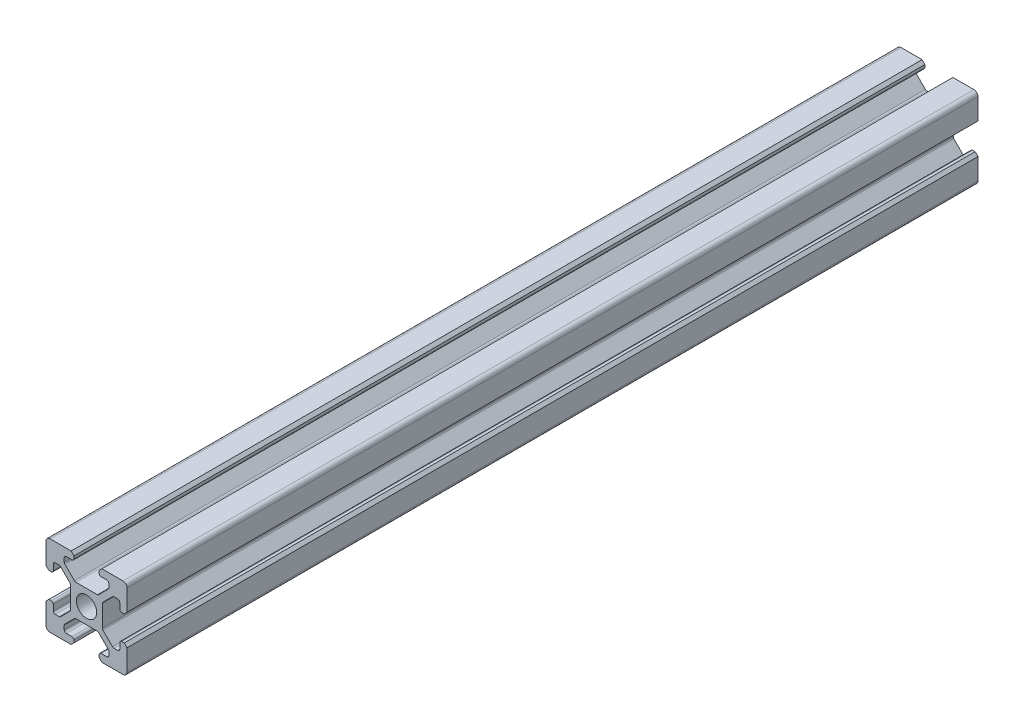
from build123d import *

# Parameters (mm, degrees)
SKETCH1_R           = 2.5
BOSS_EXTRUDE1_DEPTH = 105
FILLET1_R           = 0.5
FILLET2_R           = 0.5
FILLET3_R           = 1


with BuildPart() as part:
    # Sketch1 → Boss-Extrude1 (new, symmetric)
    with BuildSketch(Plane.XY):
        Polygon((3.9, -2.839339828), (6.560660172, -5.5), (8.200660172, -5.5), (8.200660172, -3.1), (9.3, -3.1), (10, -3.8), (10, -10), (3.8, -10), (3.1, -9.3), (3.1, -8.200660172), (5.5, -8.200660172), (5.5, -6.560660172), (2.839339828, -3.9), (-2.839339828, -3.9), (-5.5, -6.560660172), (-5.5, -8.200660172), (-3.1, -8.200660172), (-3.1, -9.3), (-3.8, -10), (-10, -10), (-10, -3.8), (-9.3, -3.1), (-8.200660172, -3.1), (-8.200660172, -5.5), (-6.560660172, -5.5), (-3.9, -2.839339828), (-3.9, 2.839339828), (-6.560660172, 5.5), (-8.200660172, 5.5), (-8.200660172, 3.1), (-9.3, 3.1), (-10, 3.8), (-10, 10), (-3.8, 10), (-3.1, 9.3), (-3.1, 8.200660172), (-5.5, 8.200660172), (-5.5, 6.560660172), (-2.839339828, 3.9), (2.839339828, 3.9), (5.5, 6.560660172), (5.5, 8.200660172), (3.1, 8.200660172), (3.1, 9.3), (3.8, 10), (10, 10), (10, 3.8), (9.3, 3.1), (8.200660172, 3.1), (8.200660172, 5.5), (6.560660172, 5.5), (3.9, 2.839339828), align=None)
        Circle(SKETCH1_R, mode=Mode.SUBTRACT)
    extrude(amount=BOSS_EXTRUDE1_DEPTH, both=True)

    # Fillet1
    fillet1_edges = [part.edges().sort_by_distance(p)[0] for p in [
        (-2.839339828, 3.9, 0),
        (2.839339828, 3.9, 0),
        (3.9, 2.839339828, 0),
        (3.9, -2.839339828, 0),
        (2.839339828, -3.9, 0),
        (-2.839339828, -3.9, 0),
        (-3.9, -2.839339828, 0),
        (-3.9, 2.839339828, 0),
    ]]
    fillet(fillet1_edges, radius=FILLET1_R)

    # Fillet2
    fillet2_edges = [part.edges().sort_by_distance(p)[0] for p in [
        (-5.5, 6.560660172, 0),
        (5.5, 6.560660172, 0),
        (5.5, 8.200660172, 0),
        (3.1, 8.200660172, 0),
        (8.200660172, 3.1, 0),
        (8.200660172, 5.5, 0),
        (6.560660172, 5.5, 0),
        (6.560660172, -5.5, 0),
        (8.200660172, -5.5, 0),
        (8.200660172, -3.1, 0),
        (3.1, -8.200660172, 0),
        (5.5, -8.200660172, 0),
        (5.5, -6.560660172, 0),
        (-5.5, -6.560660172, 0),
        (-5.5, -8.200660172, 0),
        (-3.1, -8.200660172, 0),
        (-8.200660172, -3.1, 0),
        (-8.200660172, -5.5, 0),
        (-6.560660172, -5.5, 0),
        (-6.560660172, 5.5, 0),
        (-8.200660172, 5.5, 0),
        (-8.200660172, 3.1, 0),
        (-3.1, 8.200660172, 0),
        (-5.5, 8.200660172, 0),
    ]]
    fillet(fillet2_edges, radius=FILLET2_R)

    # Fillet3
    fillet3_edges = [part.edges().sort_by_distance(p)[0] for p in [
        (10, 10, 0),
        (10, -10, 0),
        (-10, -10, 0),
        (-10, 10, 0),
    ]]
    fillet(fillet3_edges, radius=FILLET3_R)


solid = part.part
